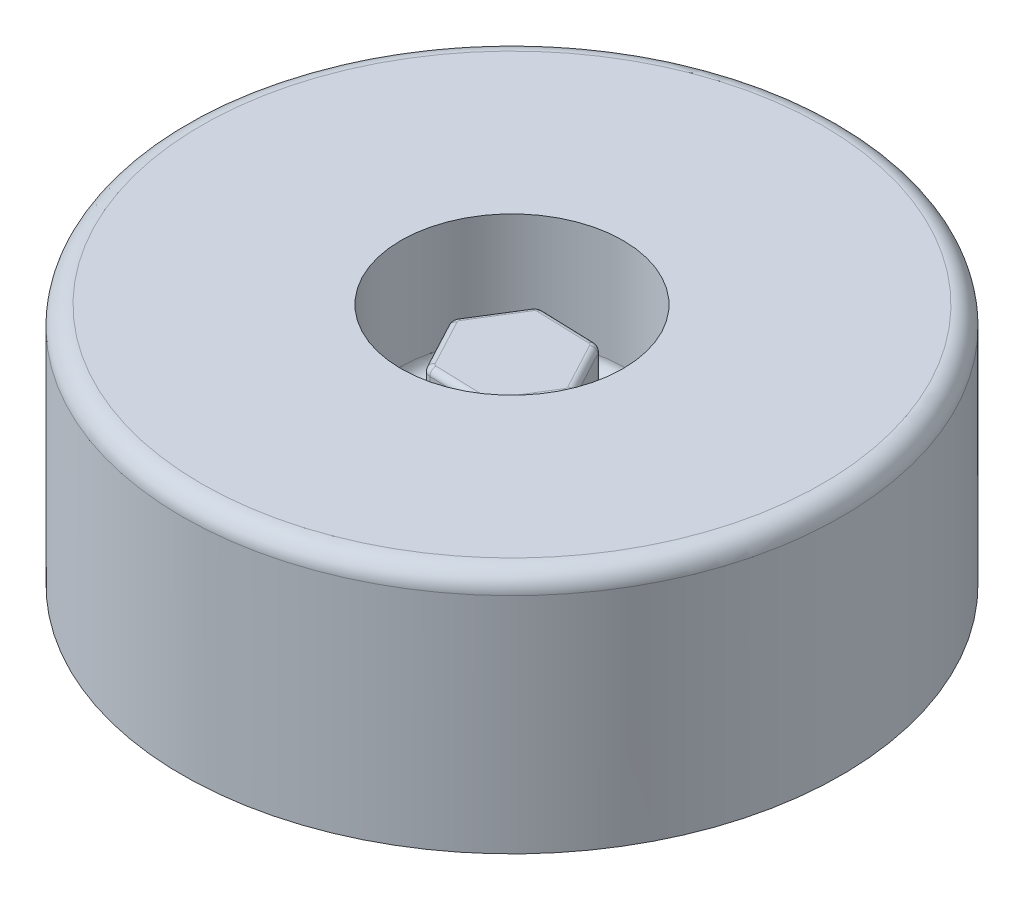
from build123d import *

# Parameters (mm, degrees)
SKETCH1_R           = 6.8961
SKETCH1_R_2         = 2.3241
BOSS_EXTRUDE1_DEPTH = 2.794
SKETCH2_R           = 2.3241
BOSS_EXTRUDE2_DEPTH = 0.254
BOSS_EXTRUDE3_DEPTH = 1.651
BOSS_EXTRUDE4_START = 2.286
SKETCH4_R           = 6.8961
BOSS_EXTRUDE4_DEPTH = 2.286
FILLET1_R           = 0.254
FILLET2_R           = 0.127
FILLET3_R           = 0.4


with BuildPart() as part:
    # Sketch1 → Boss-Extrude1 (new body)
    with BuildSketch(Plane(origin=(0, 0, 0), x_dir=(1, 0, 0), z_dir=(0, 1, 0))):
        with Locations(Location((0, 0, 0), (0, 0, 270))):
            Circle(SKETCH1_R)
        with Locations(Location((0, 0, 0), (0, 0, 270))):
            Circle(SKETCH1_R_2, mode=Mode.SUBTRACT)
    extrude(amount=BOSS_EXTRUDE1_DEPTH)

    # Sketch2 → Boss-Extrude2 (add)
    with BuildSketch(Plane.XZ):
        with Locations(Location((0, 0, 0), (0, 0, 270))):
            Circle(SKETCH2_R)
    extrude(amount=-BOSS_EXTRUDE2_DEPTH)

    # Sketch3 → Boss-Extrude3 (add)
    with BuildSketch(Plane(origin=(0, 0.254, 0), x_dir=(1, 0, 0), z_dir=(0, 1, 0))):
        with BuildLine():
            Line((-0.495805164, 1.156686678), (0.614449488, 1.120298857))
            ThreePointArc((0.614449488, 1.120298857), (0.708812351, 1.091670316), (0.776218716, 1.01969584))
            Line((0.776218716, 1.01969584), (1.299833265, 0.039993196))
            ThreePointArc((1.299833265, 0.039993196), (1.322221652, -0.056041711), (1.293593111, -0.150404573))
            Line((1.293593111, -0.150404573), (0.706953007, -1.093719397))
            ThreePointArc((0.706953007, -1.093719397), (0.634978532, -1.161125762), (0.538943625, -1.183514149))
            Line((0.538943625, -1.183514149), (-0.571311028, -1.147126328))
            ThreePointArc((-0.571311028, -1.147126328), (-0.66567389, -1.118497787), (-0.733080255, -1.046523312))
            Line((-0.733080255, -1.046523312), (-1.256694804, -0.066820667))
            ThreePointArc((-1.256694804, -0.066820667), (-1.279083191, 0.02921424), (-1.25045465, 0.123577102))
            Line((-1.25045465, 0.123577102), (-0.663814546, 1.066891925))
            ThreePointArc((-0.663814546, 1.066891925), (-0.591840071, 1.134298291), (-0.495805164, 1.156686678))
        make_face()
    extrude(amount=BOSS_EXTRUDE3_DEPTH)

    # Sketch4 → Boss-Extrude4 (add)
    with BuildSketch(Plane.XZ.offset(BOSS_EXTRUDE4_START)):
        with Locations(Location((0, 0, 0), (0, 0, 270))):
            Circle(SKETCH4_R)
    extrude(amount=-BOSS_EXTRUDE4_DEPTH)

    # Fillet1
    fillet1_edges = [part.edges().sort_by_distance(p)[0] for p in [
        (0, 0.254, -2.3241),
        (0.708812351, 0.254, -1.091670316),
        (0.059322162, 0.254, -1.138492768),
        (-0.591840071, 0.254, -1.134298291),
        (-0.957134598, 0.254, -0.595234514),
        (-1.279083191, 0.254, -0.02921424),
        (-0.99488753, 0.254, 0.556671989),
        (-0.66567389, 0.254, 1.118497787),
        (-0.016183701, 0.254, 1.165320239),
        (0.634978532, 0.254, 1.161125762),
        (1.000273059, 0.254, 0.622061985),
        (1.322221652, 0.254, 0.056041711),
        (1.038025991, 0.254, -0.529844518),
    ]]
    fillet(fillet1_edges, radius=FILLET1_R)

    # Fillet2
    fillet2_edges = [part.edges().sort_by_distance(p)[0] for p in [
        (0.708812351, 1.905, -1.091670316),
        (0.059322162, 1.905, -1.138492768),
        (-0.591840071, 1.905, -1.134298291),
        (-0.957134598, 1.905, -0.595234514),
        (-1.279083191, 1.905, -0.02921424),
        (-0.99488753, 1.905, 0.556671989),
        (-0.66567389, 1.905, 1.118497787),
        (-0.016183701, 1.905, 1.165320239),
        (0.634978532, 1.905, 1.161125762),
        (1.000273059, 1.905, 0.622061985),
        (1.322221652, 1.905, 0.056041711),
        (1.038025991, 1.905, -0.529844518),
    ]]
    fillet(fillet2_edges, radius=FILLET2_R)

    # Fillet3
    fillet3_edges = [part.edges().sort_by_distance(p)[0] for p in [
        (0, 2.794, -6.8961),
    ]]
    fillet(fillet3_edges, radius=FILLET3_R)


solid = part.part
